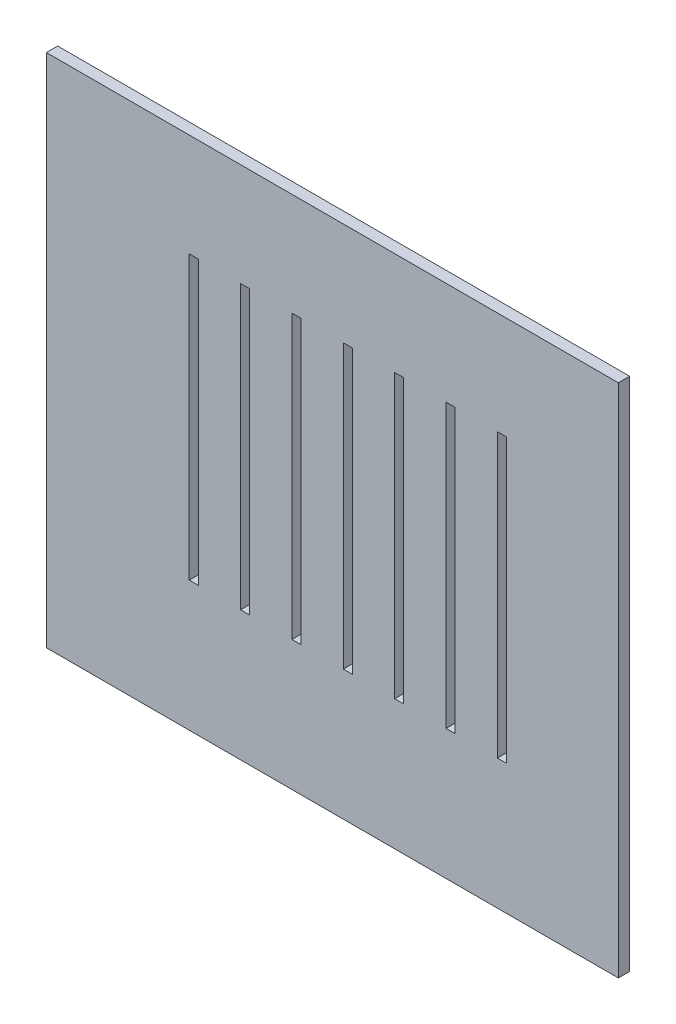
from build123d import *

# Parameters (mm, degrees)
BOSS_EXTRUDE1_DEPTH = 2
SKETCH4_W           = 1.6
SKETCH4_H           = 50
CUT_EXTRUDE1_DEPTH  = 10


with BuildPart() as part:
    # Sketch1 → Boss-Extrude1 (new body)
    with BuildSketch(Plane.XY):
        Polygon((-3.987299975, 5.359519273), (94.812700025, 5.359519273), (96.012700025, 5.359519273), (96.012700025, 96.559519273), (-5.187299975, 96.559519273), (-5.187299975, 5.359519273), align=None)
    extrude(amount=BOSS_EXTRUDE1_DEPTH)

    # Sketch4 → Cut-Extrude1 (cut)
    with BuildSketch(Plane(origin=(0, 0, 0), x_dir=(1, 0, 0), z_dir=(0, 0, -1))):
        with Locations((20.893777412, -53.359519273)):
            Rectangle(SKETCH4_W, SKETCH4_H)
        with Locations((29.980264514, -53.359519273)):
            Rectangle(SKETCH4_W, SKETCH4_H)
        with Locations((39.066751616, -53.359519273)):
            Rectangle(SKETCH4_W, SKETCH4_H)
        with Locations((48.153238719, -53.359519273)):
            Rectangle(SKETCH4_W, SKETCH4_H)
        with Locations((57.239725821, -53.359519273)):
            Rectangle(SKETCH4_W, SKETCH4_H)
        with Locations((66.326212923, -53.359519273)):
            Rectangle(SKETCH4_W, SKETCH4_H)
        with Locations((75.412700025, -53.359519273)):
            Rectangle(SKETCH4_W, SKETCH4_H)
    extrude(amount=-CUT_EXTRUDE1_DEPTH, mode=Mode.SUBTRACT)


solid = part.part
